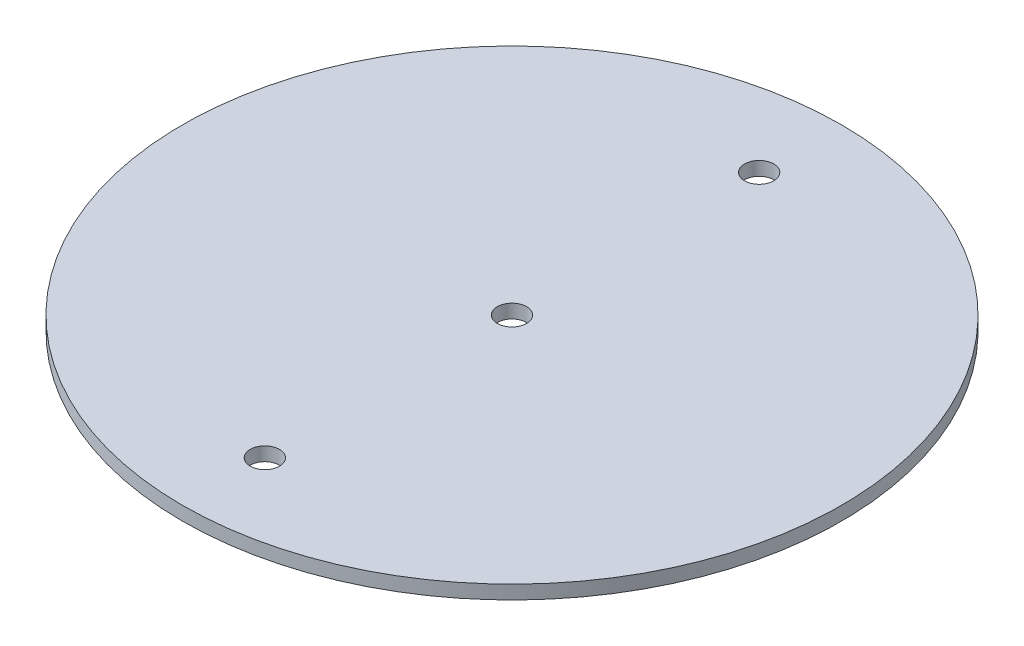
from build123d import *

# Parameters (mm, degrees)
SKETCH2_R               = 76.2
BOSS_EXTRUDE1_DEPTH     = 3.175
F_1_4_CLEARANCE_HOLE1_D = 6.7564
F_1_4_CLEARANCE_HOLE2_D = 6.7564


with BuildPart() as part:
    # Sketch2 → Boss-Extrude1 (new body)
    with BuildSketch(Plane(origin=(0, 0, 0), x_dir=(1, 0, 0), z_dir=(0, 1, 0))):
        with Locations(Location((0, 0, 0), (0, 0, 270))):
            Circle(SKETCH2_R)
    extrude(amount=BOSS_EXTRUDE1_DEPTH)

    # 1/4 Clearance Hole1 (through all)
    with Locations(Plane(origin=(0, 3.175, 0), x_dir=(1, 0, 0), z_dir=(0, 1, 0))):
        with Locations((0, 57.15), (0, -57.15)):
            Hole(F_1_4_CLEARANCE_HOLE1_D / 2)

    # 1/4 Clearance Hole2 (through all)
    with Locations(Plane(origin=(0, 3.175, 0), x_dir=(1, 0, 0), z_dir=(0, 1, 0))):
        with Locations((0, 0)):
            Hole(F_1_4_CLEARANCE_HOLE2_D / 2)


solid = part.part
